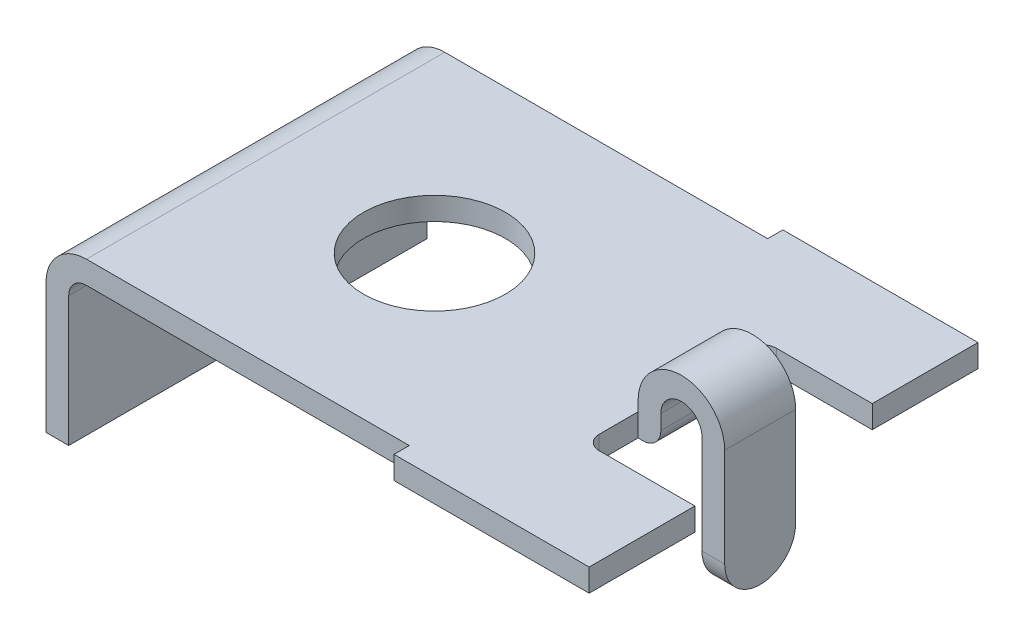
from build123d import *

# Parameters (mm, degrees)
EXTRUDE_THIN1_DEPTH = 6.4135
SKETCH2_W           = 6.985
SKETCH2_H           = 0.8128
BOSS_EXTRUDE1_DEPTH = 6.9596
SKETCH3_W           = 3.937
SKETCH3_H           = 6.35
CUT_EXTRUDE1_DEPTH  = 23.027014146
EXTRUDE_THIN2_DEPTH = 1.27
FILLET1_RADIUS      = 1.27
FILLET1_LENGTH      = 0.8128
FILLET2_R           = 0.635
SKETCH5_R           = 2.54
CUT_EXTRUDE2_DEPTH  = 23.027014146
FILLET3_R           = 0.508


with BuildPart() as part:
    # Sketch1 → Extrude-Thin1 (new, symmetric)
    with BuildSketch(Plane.XY):
        with BuildLine():
            Line((0, 0), (0, 4.6482))
            ThreePointArc((0, 4.6482), (0.424050802, 5.671949198), (1.4478, 6.096))
            Line((1.4478, 6.096), (19.9898, 6.096))
            Line((19.9898, 6.096), (19.9898, 5.2832))
            Line((19.9898, 5.2832), (1.4478, 5.2832))
            ThreePointArc((1.4478, 5.2832), (0.998787194, 5.097212806), (0.8128, 4.6482))
            Line((0.8128, 4.6482), (0.8128, 0))
            Line((0.8128, 0), (0, 0))
        make_face()
    extrude(amount=EXTRUDE_THIN1_DEPTH, both=True)

    # Sketch2 → Boss-Extrude1 (add, symmetric)
    with BuildSketch(Plane.XY):
        with Locations((16.4973, 5.6896)):
            Rectangle(SKETCH2_W, SKETCH2_H)
    extrude(amount=BOSS_EXTRUDE1_DEPTH, both=True)

    # Sketch3 → Cut-Extrude1 (cut, through all)
    with BuildSketch(Plane(origin=(0, 6.096, 0), x_dir=(1, 0, 0), z_dir=(0, 1, 0))):
        with Locations((18.0213, 0)):
            Rectangle(SKETCH3_W, SKETCH3_H)
    extrude(amount=-CUT_EXTRUDE1_DEPTH, mode=Mode.SUBTRACT)

    # Sketch4 → Extrude-Thin2 (add, symmetric)
    with BuildSketch(Plane.XY):
        with BuildLine():
            Line((16.0528, 5.2832), (16.0528, 6.4516))
            ThreePointArc((16.0528, 6.4516), (17.6022, 8.001), (19.1516, 6.4516))
            Line((19.1516, 6.4516), (19.1516, 1.651))
            Line((19.1516, 1.651), (18.3388, 1.651))
            Line((18.3388, 1.651), (18.3388, 6.4516))
            ThreePointArc((18.3388, 6.4516), (17.6022, 7.1882), (16.8656, 6.4516))
            Line((16.8656, 6.4516), (16.8656, 5.2832))
            Line((16.8656, 5.2832), (16.0528, 5.2832))
        make_face()
    extrude(amount=EXTRUDE_THIN2_DEPTH, both=True)

    # Fillet1: full round fillet: the end face becomes a half cylinder, R = half its width
    fillet1_face = Plane((18.7452, 1.651, 0), x_dir=(-1, 0, 0), z_dir=(0, -1, 0))  # on the end face: x along it, z out of the body
    fillet1_slab = fillet1_face.offset(-FILLET1_RADIUS / 2) * Box(FILLET1_LENGTH, 2 * FILLET1_RADIUS, FILLET1_RADIUS, mode=Mode.PRIVATE)  # the body's end, R deep
    fillet1_round = Plane((18.7452, 2.921, 0), x_dir=(0, -1, 0), z_dir=(-1, 0, 0)) * Cylinder(FILLET1_RADIUS, FILLET1_LENGTH, mode=Mode.PRIVATE)  # its axis R under the face
    add(fillet1_slab - fillet1_round, mode=Mode.SUBTRACT)

    # Fillet2
    fillet2_edges = [part.edges().sort_by_distance(p)[0] for p in [
        (16.8656, 5.2832, 0),
    ]]
    fillet(fillet2_edges, radius=FILLET2_R)

    # Sketch5 → Cut-Extrude2 (cut, through all)
    with BuildSketch(Plane(origin=(0, 6.096, 0), x_dir=(1, 0, 0), z_dir=(0, 1, 0))):
        with Locations(Location((7.493, 0, 0), (0, 0, 270))):
            Circle(SKETCH5_R)
    extrude(amount=-CUT_EXTRUDE2_DEPTH, mode=Mode.SUBTRACT)

    # Fillet3
    fillet3_edges = [part.edges().sort_by_distance(p)[0] for p in [
        (16.0528, 5.6896, 3.175),
        (16.0528, 5.6896, -3.175),
    ]]
    fillet(fillet3_edges, radius=FILLET3_R)


solid = part.part
